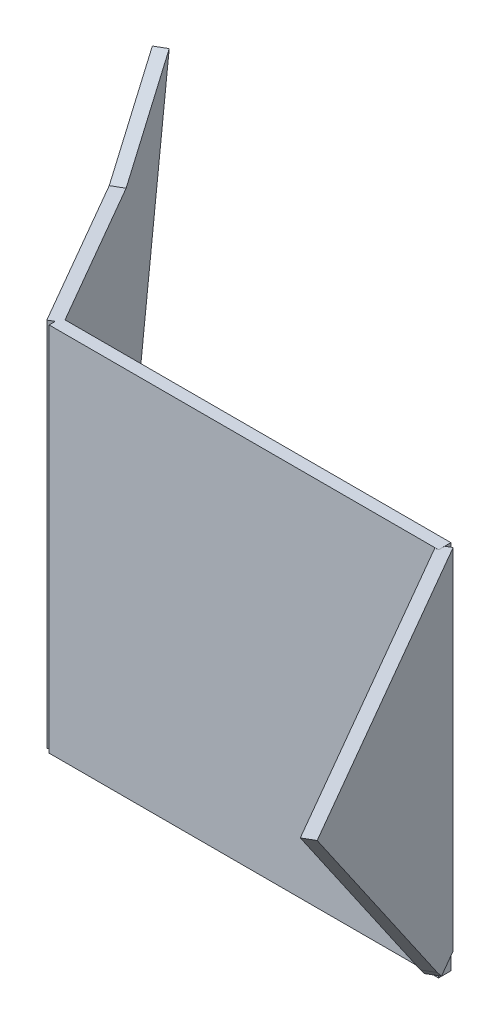
from build123d import *

# Parameters (mm, degrees)
ESBO_O1_W                = 63
ESBO_O1_H                = 60
RESSALTO_EXTRUS_O1_DEPTH = 1
RESSALTO_EXTRUS_O2_DEPTH = 1
RESSALTO_EXTRUS_O3_DEPTH = 1


with BuildPart() as part:
    # Esboço1 → Ressalto-extrusão1 (new, symmetric)
    with BuildSketch(Plane.XY):
        Rectangle(ESBO_O1_W, ESBO_O1_H)
    extrude(amount=RESSALTO_EXTRUS_O1_DEPTH, both=True)

    # Esboço2 → Ressalto-extrusão2 (add, symmetric)
    with BuildSketch(Plane(origin=(23.625, 0, -13.63990011), x_dir=(0, -1, 0), z_dir=(-0.8660254037844416, 0, 0.49999999999999495))):
        Polygon((-29.995618948, 75.849181721), (-29.995618948, 15.75), (26.534381052, 15.75), (26.534381052, 20.91864534), (24.774381052, 22.73864534), align=None)
    extrude(amount=RESSALTO_EXTRUS_O2_DEPTH, both=True)

    # Esboço3 → Ressalto-extrusão3 (add, symmetric)
    with BuildSketch(Plane(origin=(-23.625, 0, 13.63990011), x_dir=(0, -1, 0), z_dir=(0.866025403784445, 0, -0.4999999999999889))):
        Polygon((30, 15.75), (-30, 15.75), (-30, 43.326372281), (-36.552202997, 62.375919638), (17.643604412, 43.326372281), align=None)
    extrude(amount=RESSALTO_EXTRUS_O3_DEPTH, both=True)


solid = part.part
